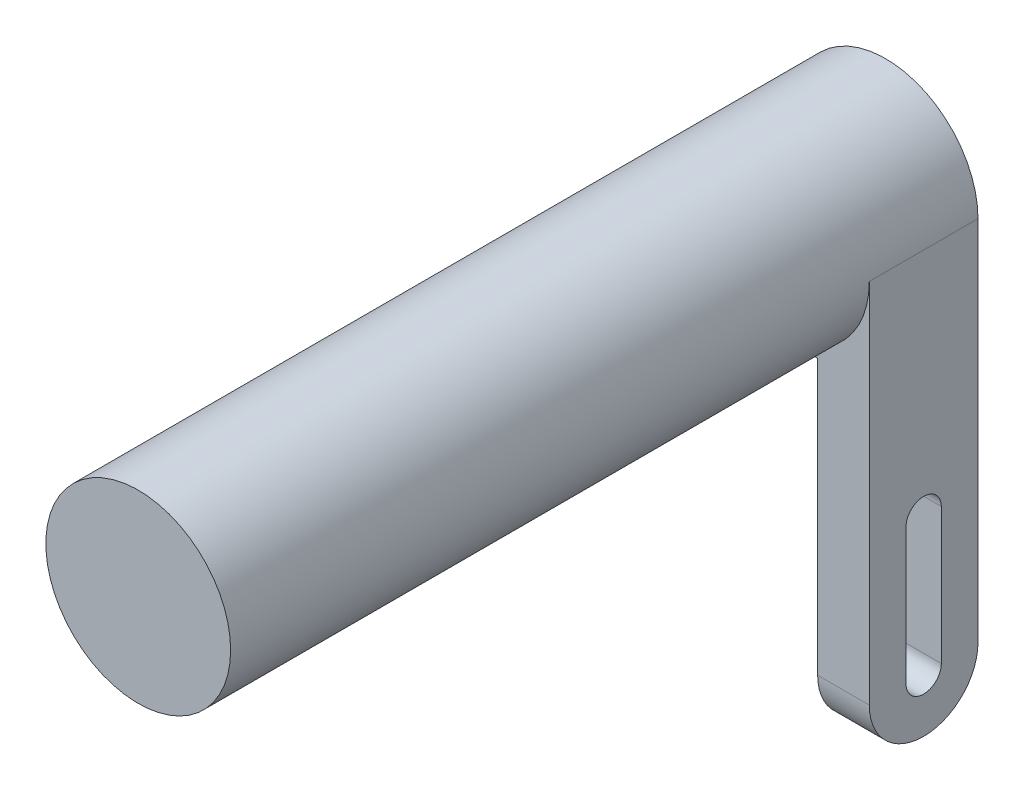
from build123d import *

# Parameters (mm, degrees)
ESQUISSE5_R        = 3.4
ESQUISSE5_R_2      = 2.6
BOSS_EXTRU_1_DEPTH = 27
ESQUISSE6_R        = 3.4
BOSS_EXTRU_2_DEPTH = 0.5
BOSS_EXTRU_4_START = 1.5
BOSS_EXTRU_4_DEPTH = 1.9
BOSS_EXTRU_5_DEPTH = 4


with BuildPart() as part:
    # Esquisse5 → Boss.-Extru.1 (new body)
    with BuildSketch(Plane.XY):
        Circle(ESQUISSE5_R)
        Circle(ESQUISSE5_R_2, mode=Mode.SUBTRACT)
    extrude(amount=BOSS_EXTRU_1_DEPTH)

    # Esquisse6 → Boss.-Extru.2 (add)
    with BuildSketch(Plane.XY.offset(27)):
        Circle(ESQUISSE6_R)
    extrude(amount=BOSS_EXTRU_2_DEPTH)



with BuildPart() as body_2:
    # Esquisse9 → Boss.-Extru.4 (new body)
    with BuildSketch(Plane(origin=(0, 0, 0), x_dir=(0, 0, -1), z_dir=(1, 0, 0)).offset(BOSS_EXTRU_4_START)):
        with BuildLine():
            Line((-4, -3.4), (-4, -13.5))
            ThreePointArc((-4, -13.5), (-2, -15.5), (0, -13.5))
            Line((0, -13.5), (0, -3.4))
            Line((0, -3.4), (-4, -3.4))
        make_face()
        with BuildLine():
            ThreePointArc((-1.35, -8.5), (-2, -7.85), (-2.65, -8.5))
            Line((-2.65, -8.5), (-2.65, -13.5))
            ThreePointArc((-2.65, -13.5), (-2, -14.15), (-1.35, -13.5))
            Line((-1.35, -13.5), (-1.35, -8.5))
        make_face(mode=Mode.SUBTRACT)
    extrude(amount=BOSS_EXTRU_4_DEPTH)


with BuildPart() as part_1:
    add(part.part)

    add(body_2.part)  # Boss.-Extru.5 merges body 2
    # Esquisse10 → Boss.-Extru.5 (add)
    with BuildSketch(Plane(origin=(0, 0, 0), x_dir=(-1, 0, 0), z_dir=(0, 0, -1))):
        with BuildLine():
            Line((-3.4, -3.4), (0, -3.4))
            ThreePointArc((0, -3.4), (-2.404163056, -2.404163056), (-3.4, 0))
            Line((-3.4, 0), (-3.4, -3.4))
        make_face()
    extrude(amount=-BOSS_EXTRU_5_DEPTH)


solid = part_1.part
